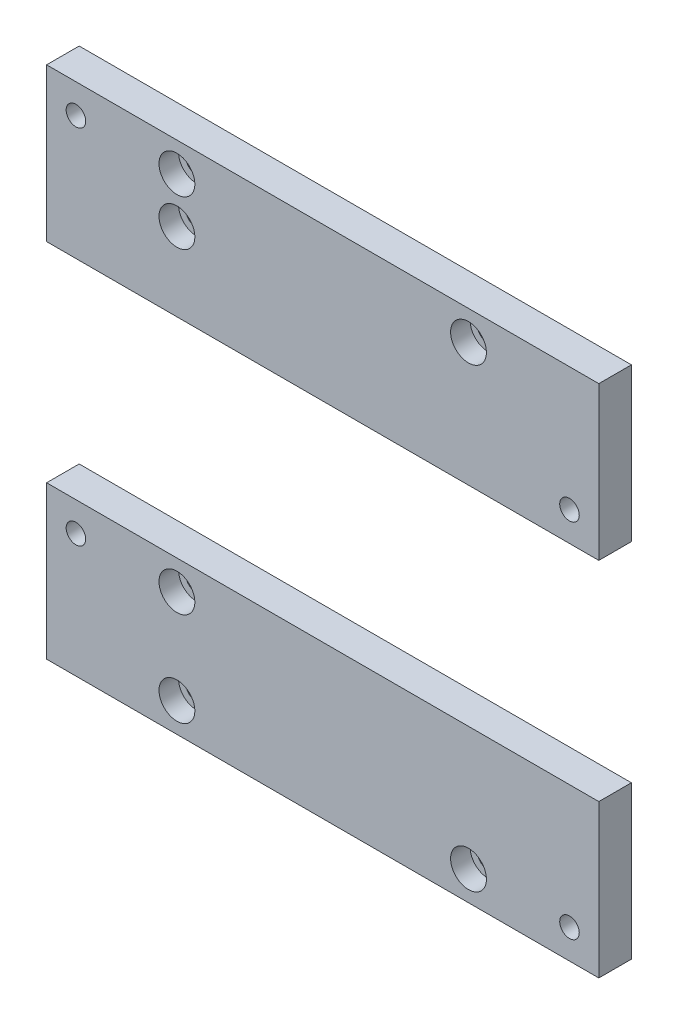
from build123d import *

# Parameters (mm, degrees)
SKETCH2_W                                = 169.5
SKETCH2_H                                = 46.9
BOSS_EXTRUDE1_DEPTH                      = 10
SKETCH2_H_2                              = 47
BOSS_EXTRUDE1_2_DEPTH                    = 10
CBORE_FOR_M6_SHCS1_AT_2_COUNT            = 2
CBORE_FOR_M6_SHCS1_AT_2_PITCH            = 89.5
CBORE_FOR_M6_SHCS1_AT_3_COUNT            = 2
CBORE_FOR_M6_SHCS1_AT_3_PITCH            = 94.050305688
CBORE_FOR_M6_SHCS2_AT_2_COUNT            = 2
CBORE_FOR_M6_SHCS2_AT_2_PITCH            = 90.58835466
CBORE_FOR_M6_SHCS2_AT_3_COUNT            = 2
CBORE_FOR_M6_SHCS2_AT_3_PITCH            = 89.5
SKETCH8_W                                = 3
SKETCH8_H                                = 10
F_6_0MM_CLEARANCE_DOWEL_HOLE1_AT_2_COUNT = 2
F_6_0MM_CLEARANCE_DOWEL_HOLE1_AT_2_PITCH = 154.250607778
SKETCH10_W                               = 3
SKETCH10_H                               = 10
F_6_0MM_CLEARANCE_DOWEL_HOLE2_AT_2_COUNT = 2
F_6_0MM_CLEARANCE_DOWEL_HOLE2_AT_2_PITCH = 154.231838477


with BuildPart() as part:
    # Sketch2 → Boss-Extrude1 (new body)
    with BuildSketch(Plane.XY):
        with Locations((34.75, -55.55)):
            Rectangle(SKETCH2_W, SKETCH2_H)
    extrude(amount=BOSS_EXTRUDE1_DEPTH)

    # Sketch4 → CBORE for M6 SHCS1 (revolve, cut)
    with BuildSketch(Plane(origin=(79.5, -70, 10), x_dir=(0, -1, 0), z_dir=(1, 0, 0))):
        Polygon((0, 0), (0, 10), (3.3, 10), (3.3, 6), (5.5, 6), (5.5, 0), align=None)
    cbore_for_m6_shcs1 = revolve(axis=Axis((79.5, -70, 16.35), (0, 0, -1)), mode=Mode.SUBTRACT)

    # CBORE for M6 SHCS1 at 2: CBORE for M6 SHCS1 ×2
    with Locations(*[(-i * CBORE_FOR_M6_SHCS1_AT_2_PITCH, 0, 0) for i in range(1, CBORE_FOR_M6_SHCS1_AT_2_COUNT)]):
        add(cbore_for_m6_shcs1, mode=Mode.SUBTRACT)

    # CBORE for M6 SHCS1 at 3: CBORE for M6 SHCS1 ×2
    with Locations(*[Vector(-0.9516183849198379, 0.3072823611640593, 0) * (i * CBORE_FOR_M6_SHCS1_AT_3_PITCH) for i in range(1, CBORE_FOR_M6_SHCS1_AT_3_COUNT)]):
        add(cbore_for_m6_shcs1, mode=Mode.SUBTRACT)

    # Sketch10 → Ø6.0mm Clearance Dowel Hole2 (revolve, cut)
    with BuildSketch(Plane(origin=(-41, -41.1, 10), x_dir=(0, -1, 0), z_dir=(1, 0, 0))):
        with Locations((1.5, 5)):
            Rectangle(SKETCH10_W, SKETCH10_H)
    f_6_0mm_clearance_dowel_hole2 = revolve(axis=Axis((-41, -41.1, 16.35), (0, 0, -1)), mode=Mode.SUBTRACT)

    # Ø6.0mm Clearance Dowel Hole2 at 2: Ø6.0mm Clearance Dowel Hole2 ×2
    with Locations(*[Vector(0.9822874543674588, -0.18738024707075618, 0) * (i * F_6_0MM_CLEARANCE_DOWEL_HOLE2_AT_2_PITCH) for i in range(1, F_6_0MM_CLEARANCE_DOWEL_HOLE2_AT_2_COUNT)]):
        add(f_6_0mm_clearance_dowel_hole2, mode=Mode.SUBTRACT)


with BuildPart() as body_2:
    # Sketch2 → Boss-Extrude1 2 (new body)
    with BuildSketch(Plane.XY):
        with Locations((34.75, 55.5)):
            Rectangle(SKETCH2_W, SKETCH2_H_2)
    extrude(amount=BOSS_EXTRUDE1_2_DEPTH)

    # Sketch6 → CBORE for M6 SHCS2 (revolve, cut)
    with BuildSketch(Plane(origin=(79.5, 70, 10), x_dir=(0, -1, 0), z_dir=(1, 0, 0))):
        Polygon((0, 0), (0, 10), (3.3, 10), (3.3, 6), (5.5, 6), (5.5, 0), align=None)
    cbore_for_m6_shcs2 = revolve(axis=Axis((79.5, 70, 16.35), (0, 0, -1)), mode=Mode.SUBTRACT)

    # CBORE for M6 SHCS2 at 2: CBORE for M6 SHCS2 ×2
    with Locations(*[Vector(-0.9879857111429782, -0.15454525090504667, 0) * (i * CBORE_FOR_M6_SHCS2_AT_2_PITCH) for i in range(1, CBORE_FOR_M6_SHCS2_AT_2_COUNT)]):
        add(cbore_for_m6_shcs2, mode=Mode.SUBTRACT)

    # CBORE for M6 SHCS2 at 3: CBORE for M6 SHCS2 ×2
    with Locations(*[(-i * CBORE_FOR_M6_SHCS2_AT_3_PITCH, 0, 0) for i in range(1, CBORE_FOR_M6_SHCS2_AT_3_COUNT)]):
        add(cbore_for_m6_shcs2, mode=Mode.SUBTRACT)

    # Sketch8 → Ø6.0mm Clearance Dowel Hole1 (revolve, cut)
    with BuildSketch(Plane(origin=(-41, 70, 10), x_dir=(0, -1, 0), z_dir=(1, 0, 0))):
        with Locations((1.5, 5)):
            Rectangle(SKETCH8_W, SKETCH8_H)
    f_6_0mm_clearance_dowel_hole1 = revolve(axis=Axis((-41, 70, 16.35), (0, 0, -1)), mode=Mode.SUBTRACT)

    # Ø6.0mm Clearance Dowel Hole1 at 2: Ø6.0mm Clearance Dowel Hole1 ×2
    with Locations(*[Vector(0.9821679290733613, -0.18800574219886163, 0) * (i * F_6_0MM_CLEARANCE_DOWEL_HOLE1_AT_2_PITCH) for i in range(1, F_6_0MM_CLEARANCE_DOWEL_HOLE1_AT_2_COUNT)]):
        add(f_6_0mm_clearance_dowel_hole1, mode=Mode.SUBTRACT)


solid = Compound([part.part, body_2.part])
